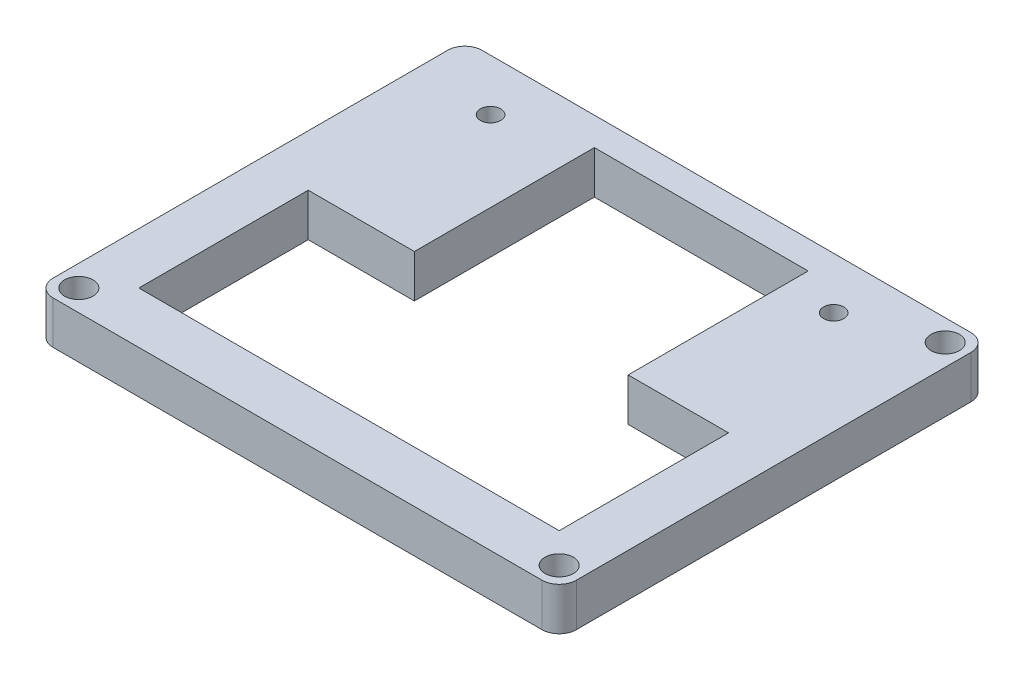
from build123d import *

# Parameters (mm, degrees)
SKETCH1_W           = 77.47
SKETCH1_H           = 63.5
BOSS_EXTRUDE1_DEPTH = 6.35
SKETCH2_R           = 2.1
CUT_EXTRUDE1_DEPTH  = 6.35
FILLET1_R           = 2.54
SKETCH3_R           = 1.5
CUT_EXTRUDE2_DEPTH  = 10.16


with BuildPart() as part:
    # Sketch1 → Boss-Extrude1 (new body)
    with BuildSketch(Plane(origin=(0, 0, 0), x_dir=(1, 0, 0), z_dir=(0, 1, 0))):
        with Locations((38.735, 31.75)):
            Rectangle(SKETCH1_W, SKETCH1_H)
        Polygon((23.33761346, 32.697540577), (23.33761346, 59.344124755), (54.982420655, 59.344124755), (54.982420655, 32.697540577), (69.85, 32.697540577), (69.85, 7.62), (7.62, 7.62), (7.62, 32.697540577), align=None, mode=Mode.SUBTRACT)
    extrude(amount=BOSS_EXTRUDE1_DEPTH)

    # Sketch2 → Cut-Extrude1 (cut)
    with BuildSketch(Plane(origin=(0, 6.35, 0), x_dir=(1, 0, 0), z_dir=(0, 1, 0))):
        with Locations(Location((3.175, 3.175, 0), (0, 0, 270))):
            Circle(SKETCH2_R)
        with Locations(Location((74.295, 3.175, 0), (0, 0, 270))):
            Circle(SKETCH2_R)
        with Locations(Location((74.295, 60.325, 0), (0, 0, 270))):
            Circle(SKETCH2_R)
    extrude(amount=-CUT_EXTRUDE1_DEPTH, mode=Mode.SUBTRACT)

    # Fillet1
    fillet1_edges = [part.edges().sort_by_distance(p)[0] for p in [
        (0, 3.175, 0),
        (0, 3.175, -63.5),
        (77.47, 3.175, -63.5),
        (77.47, 3.175, 0),
    ]]
    fillet(fillet1_edges, radius=FILLET1_R)

    # Sketch3 → Cut-Extrude2 (cut)
    with BuildSketch(Plane(origin=(0, 6.35, 0), x_dir=(1, 0, 0), z_dir=(0, 1, 0))):
        with Locations(Location((11.43, 55.88, 0), (0, 0, 270))):
            Circle(SKETCH3_R)
        with Locations(Location((62.23, 55.88, 0), (0, 0, 270))):
            Circle(SKETCH3_R)
    extrude(amount=-CUT_EXTRUDE2_DEPTH, mode=Mode.SUBTRACT)


solid = part.part
